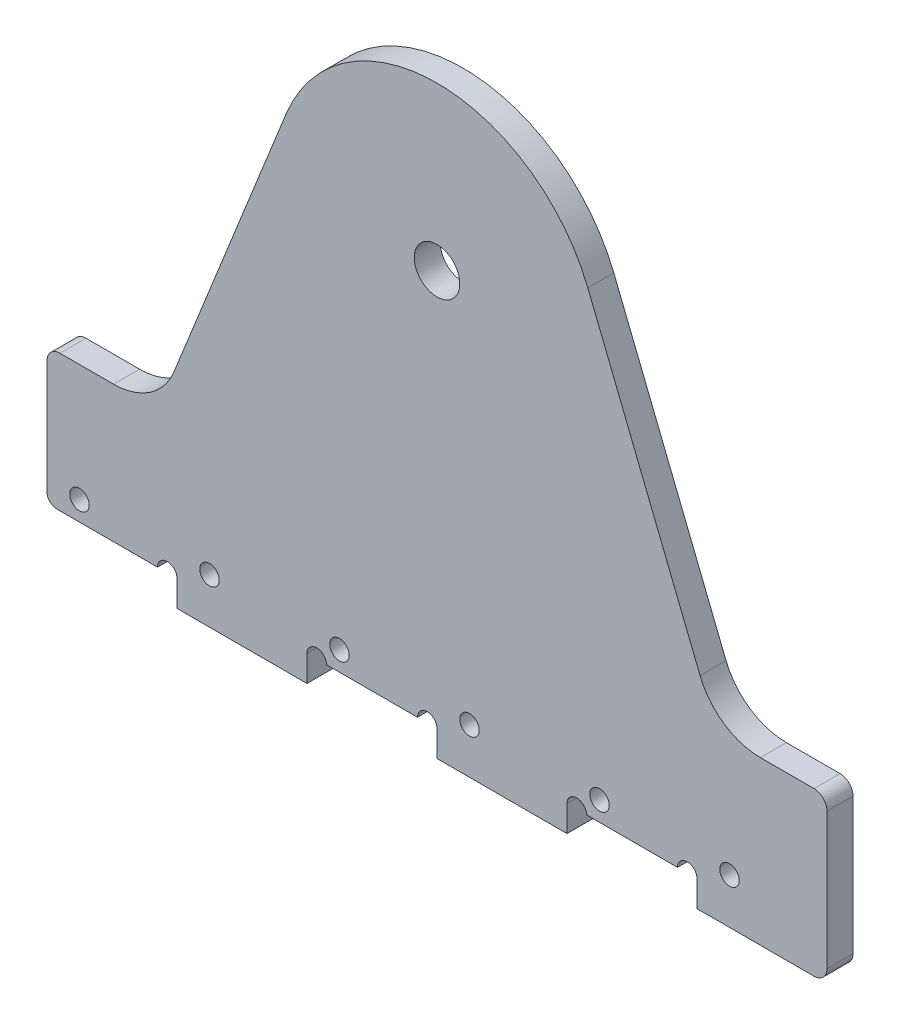
from build123d import *

# Parameters (mm, degrees)
SKETCH_1_R          = 3.5
EXTRUDE_1_DEPTH     = 4
FILLET_1_R          = 10
FILLET_2_R          = 2
CUT_EXTRUDE_1_DEPTH = 10
FILLET_3_R          = 1.5
SKETCH_3_R          = 1.5
CUT_EXTRUDE_2_DEPTH = 4


with BuildPart() as part:
    # 草图1 → 凸台-拉伸1 (new body)
    # profile 1 of 2: a face of its own
    with BuildSketch(Plane.XY):
        with BuildLine():
            ThreePointArc((23.201709249, 9.310246395), (0, 25), (-23.201709249, 9.310246395))
            ThreePointArc((-23.201709249, 9.310246395), (-4.741163822, -24.546310631), (25, 0))
            ThreePointArc((25, 0), (24.546310631, 4.741163822), (23.201709249, 9.310246395))
        make_face()
        Circle(SKETCH_1_R, mode=Mode.SUBTRACT)
    # profile 2 of 2: a face of its own
    with BuildSketch(Plane.XY):
        with BuildLine():
            ThreePointArc((25, 0), (-4.741163822, -24.546310631), (-23.201709249, 9.310246395))
            Line((-23.201709249, 9.310246395), (-42.988636962, -40))
            Line((-42.988636962, -40), (-60, -40))
            Line((-60, -40), (-60, -65))
            Line((-60, -65), (60, -65))
            Line((60, -65), (60, -40))
            Line((60, -40), (42.988636962, -40))
            Line((42.988636962, -40), (23.201709249, 9.310246395))
            ThreePointArc((23.201709249, 9.310246395), (24.546310631, 4.741163822), (25, 0))
        make_face()
    extrude(amount=EXTRUDE_1_DEPTH)

    # 圆角1
    fillet_1_edges = [part.edges().sort_by_distance(p)[0] for p in [
        (42.988636962, -40, 2),
        (-42.988636962, -40, 2),
    ]]
    fillet(fillet_1_edges, radius=FILLET_1_R)

    # 圆角2
    fillet_2_edges = [part.edges().sort_by_distance(p)[0] for p in [
        (60, -40, 2),
        (60, -65, 2),
        (-60, -65, 2),
        (-60, -40, 2),
    ]]
    fillet(fillet_2_edges, radius=FILLET_2_R)

    # 草图2 → 切除-拉伸1 (cut)
    with BuildSketch(Plane.XY.offset(4)):
        with BuildLine():
            Line((-43, -61), (-40, -61))
            ThreePointArc((-40, -61), (-41.5, -59.5), (-43, -61))
        make_face()
        with BuildLine():
            ThreePointArc((-60, -63), (-59.414213562, -64.414213562), (-58, -65))
            Line((-58, -65), (-40, -65))
            Line((-40, -65), (-40, -61))
            Line((-40, -61), (-43, -61))
            Line((-43, -61), (-60, -61))
            Line((-60, -61), (-60, -63))
        make_face()
        with BuildLine():
            ThreePointArc((-17, -61), (-18.5, -59.5), (-20, -61))
            Line((-20, -61), (-17, -61))
        make_face()
        Polygon((-20, -61), (-20, -65), (0, -65), (0, -61), (-3, -61), (-17, -61), align=None)
        with BuildLine():
            Line((-3, -61), (0, -61))
            ThreePointArc((0, -61), (-1.5, -59.5), (-3, -61))
        make_face()
        with BuildLine():
            ThreePointArc((23, -61), (21.5, -59.5), (20, -61))
            Line((20, -61), (23, -61))
        make_face()
        Polygon((20, -61), (20, -65), (40, -65), (40, -61), (37, -61), (23, -61), align=None)
        with BuildLine():
            Line((37, -61), (40, -61))
            ThreePointArc((40, -61), (38.5, -59.5), (37, -61))
        make_face()
    extrude(amount=-CUT_EXTRUDE_1_DEPTH, mode=Mode.SUBTRACT)

    # 圆角3
    fillet_3_edges = [part.edges().sort_by_distance(p)[0] for p in [
        (-60, -61, 2),
    ]]
    fillet(fillet_3_edges, radius=FILLET_3_R)

    # 草图3 → 切除-拉伸2 (cut)
    with BuildSketch(Plane.XY.offset(4)):
        with Locations((-55, -58)):
            Circle(SKETCH_3_R)
        with Locations((-35, -58)):
            Circle(SKETCH_3_R)
        with Locations((-15, -58)):
            Circle(SKETCH_3_R)
        with Locations((5, -58)):
            Circle(SKETCH_3_R)
        with Locations((25, -58)):
            Circle(SKETCH_3_R)
        with Locations((45, -58)):
            Circle(SKETCH_3_R)
    extrude(amount=-CUT_EXTRUDE_2_DEPTH, mode=Mode.SUBTRACT)


solid = part.part
